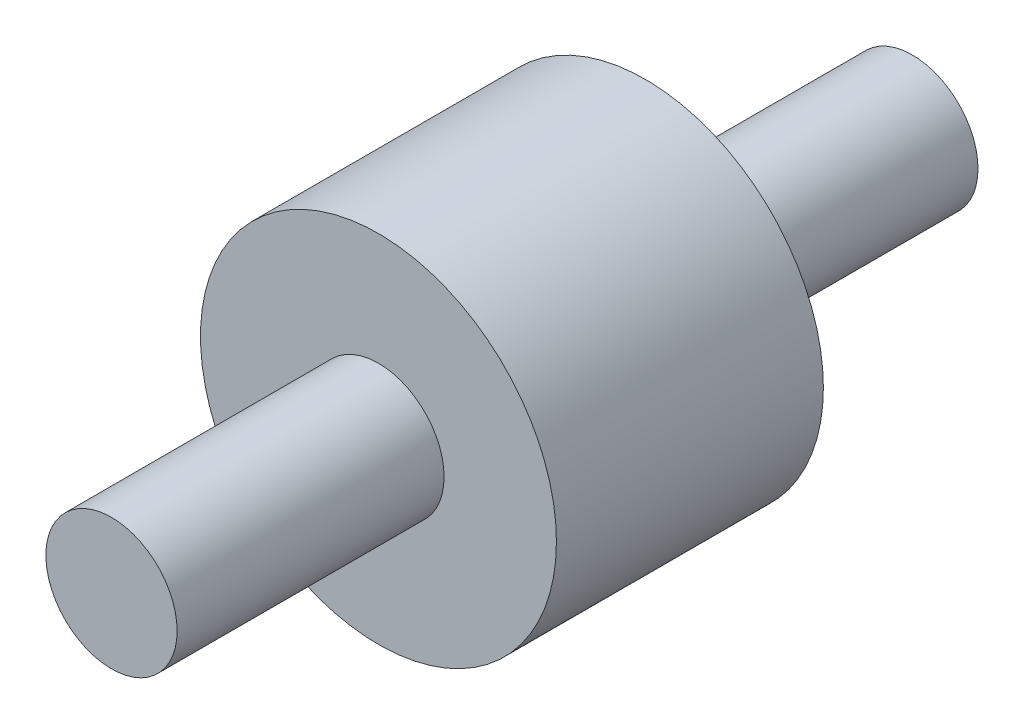
from build123d import *

# Parameters (mm, degrees)
CROQUIS1_R              = 8
SALIENTE_EXTRUIR1_DEPTH = 6
CROQUIS2_R              = 2.95
SALIENTE_EXTRUIR2_DEPTH = 12


with BuildPart() as part:
    # Croquis1 → Saliente-Extruir1 (new, symmetric)
    with BuildSketch(Plane.XY):
        Circle(CROQUIS1_R)
    extrude(amount=SALIENTE_EXTRUIR1_DEPTH, both=True)

    # Croquis2 → Saliente-Extruir2 (add)
    with BuildSketch(Plane.XY.offset(6)):
        Circle(CROQUIS2_R)
    saliente_extruir2 = extrude(amount=SALIENTE_EXTRUIR2_DEPTH)

    # Simetría1: Saliente-Extruir2 across plane
    add(saliente_extruir2.mirror(Plane.XY))


solid = part.part
